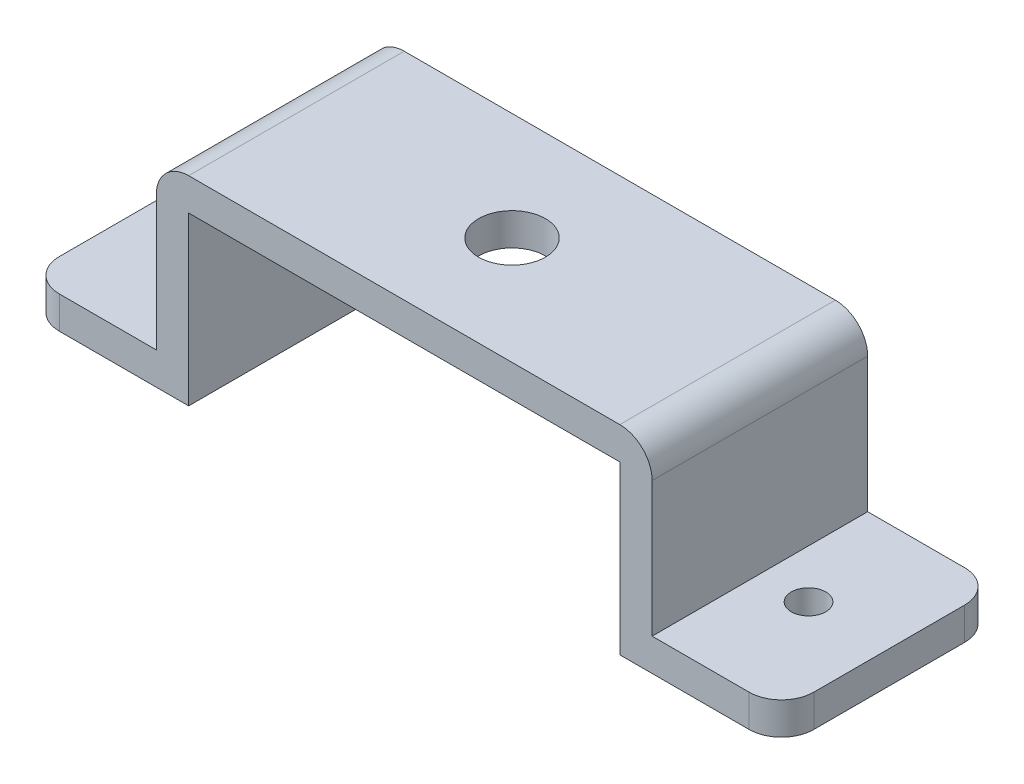
from build123d import *

# Parameters (mm, degrees)
SKETCH1_W           = 70
SKETCH1_H           = 20
BOSS_EXTRUDE2_DEPTH = 3
SKETCH3_W           = 3
SKETCH3_H           = 20
BOSS_EXTRUDE3_DEPTH = 18
SKETCH4_W           = 46
SKETCH4_H           = 20
BOSS_EXTRUDE4_DEPTH = 3
SKETCH5_W           = 40
SKETCH5_H           = 3
CUT_EXTRUDE2_DEPTH  = 47.914816423
SKETCH6_R           = 3.1
CUT_EXTRUDE3_DEPTH  = 43.023802779
FILLET2_R           = 3
SKETCH7_R           = 1.6
CUT_EXTRUDE4_DEPTH  = 44.600458713
CUT_EXTRUDE5_DEPTH  = 26
SKETCH10_W          = 46
SKETCH10_H          = 20
BOSS_EXTRUDE5_DEPTH = 3
SKETCH11_R          = 3.1
CUT_EXTRUDE6_DEPTH  = 3
FILLET3_R           = 3


with BuildPart() as part:
    # Sketch1 → Boss-Extrude2 (new body)
    with BuildSketch(Plane(origin=(0, 0, 0), x_dir=(1, 0, 0), z_dir=(0, 1, 0))):
        Rectangle(SKETCH1_W, SKETCH1_H)
    extrude(amount=BOSS_EXTRUDE2_DEPTH)

    # Sketch3 → Boss-Extrude3 (add)
    with BuildSketch(Plane(origin=(0, 3, 0), x_dir=(1, 0, 0), z_dir=(0, 1, 0))):
        with Locations((21.5, 0)):
            Rectangle(SKETCH3_W, SKETCH3_H)
        with Locations((-21.5, 0)):
            Rectangle(SKETCH3_W, SKETCH3_H)
    extrude(amount=BOSS_EXTRUDE3_DEPTH)

    # Sketch4 → Boss-Extrude4 (add)
    with BuildSketch(Plane(origin=(0, 21, 0), x_dir=(1, 0, 0), z_dir=(0, 1, 0))):
        Rectangle(SKETCH4_W, SKETCH4_H)
    extrude(amount=BOSS_EXTRUDE4_DEPTH)

    # Sketch5 → Cut-Extrude2 (cut, through all)
    with BuildSketch(Plane.XY.offset(10)):
        with Locations((0, 1.5)):
            Rectangle(SKETCH5_W, SKETCH5_H)
    extrude(amount=-CUT_EXTRUDE2_DEPTH, mode=Mode.SUBTRACT)

    # Sketch6 → Cut-Extrude3 (cut, through all)
    with BuildSketch(Plane.XZ.offset(-21)):
        with Locations(Location((0, 0, 0), (0, 0, 270))):
            Circle(SKETCH6_R)
    extrude(amount=-CUT_EXTRUDE3_DEPTH, mode=Mode.SUBTRACT)

    # Fillet2
    fillet2_edges = [part.edges().sort_by_distance(p)[0] for p in [
        (-23, 24, 0),
        (23, 24, 0),
        (35, 1.5, 10),
        (-35, 1.5, 10),
        (-35, 1.5, -10),
        (35, 1.5, -10),
    ]]
    fillet(fillet2_edges, radius=FILLET2_R)

    # Sketch7 → Cut-Extrude4 (cut, through all)
    with BuildSketch(Plane.XZ):
        with Locations(Location((-27.499620905, -0.010826829, 0), (0, 0, 270))):
            Circle(SKETCH7_R)
        with Locations(Location((27.500379095, -0.010826829, 0), (0, 0, 270))):
            Circle(SKETCH7_R)
    extrude(amount=-CUT_EXTRUDE4_DEPTH, mode=Mode.SUBTRACT)

    # Sketch9 → Cut-Extrude5 (cut)
    with BuildSketch(Plane.XY.offset(10)):
        Polygon((0, 15.5), (-23, 15.5), (-23, 32.171258166), (25.72707431, 32.171258166), (25.72707431, 15.5), align=None)
    extrude(amount=-CUT_EXTRUDE5_DEPTH, mode=Mode.SUBTRACT)


with BuildPart() as cut_extrude5_piece_1:
    # of the separate pieces the step leaves, piece 1, a body of its own (cut_extrude5_pieces)
    add(part.part.solids().sort_by_distance((20, 15.5, 10))[0])



with BuildPart() as cut_extrude5_piece_2:
    # of the separate pieces the step leaves, piece 2, a body of its own (cut_extrude5_pieces)
    add(part.part.solids().sort_by_distance((-32, 0, 10))[0])


with BuildPart() as cut_extrude5_piece_1_1:
    add(cut_extrude5_piece_1.part)

    add(cut_extrude5_piece_2.part)  # Boss-Extrude5 merges Cut-Extrude5 piece 2
    # Sketch10 → Boss-Extrude5 (add)
    with BuildSketch(Plane(origin=(0, 15.5, 0), x_dir=(1, 0, 0), z_dir=(0, 1, 0))):
        Rectangle(SKETCH10_W, SKETCH10_H)
    extrude(amount=BOSS_EXTRUDE5_DEPTH)

    # Sketch11 → Cut-Extrude6 (cut)
    with BuildSketch(Plane(origin=(0, 18.5, 0), x_dir=(1, 0, 0), z_dir=(0, 1, 0))):
        with Locations(Location((0, 0, 0), (0, 0, 270))):
            Circle(SKETCH11_R)
    extrude(amount=-CUT_EXTRUDE6_DEPTH, mode=Mode.SUBTRACT)

    # Fillet3
    fillet3_edges = [cut_extrude5_piece_1_1.edges().sort_by_distance(p)[0] for p in [
        (-23, 18.5, 0),
        (23, 18.5, 0),
    ]]
    fillet(fillet3_edges, radius=FILLET3_R)


solid = cut_extrude5_piece_1_1.part
